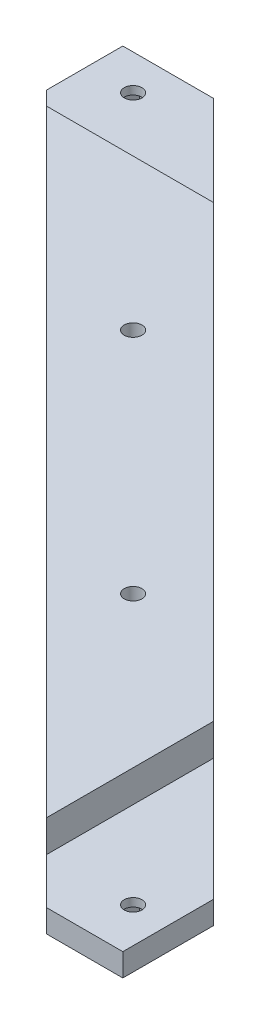
from build123d import *

# Parameters (mm, degrees)
BOSS_EXTRUDE1_DEPTH      = 12
SKETCH2_R                = 1.95
CUT_EXTRUDE1_DEPTH       = 244.540551038
SKETCH3_W                = 47
SKETCH3_H                = 27
SKETCH3_W_2              = 27
SKETCH3_H_2              = 47
CUT_EXTRUDE2_DEPTH       = 7
CUT_EXTRUDE8_DEPTH       = 244.540551038
CUT_EXTRUDE8_DEPTH_BACK  = 244.540551038
SKETCH5_R                = 1.95
CUT_EXTRUDE9_DEPTH       = 3.2
CUT_EXTRUDE10_DEPTH      = 244.540551038
CUT_EXTRUDE10_DEPTH_BACK = 244.540551038


with BuildPart() as part:
    # Sketch1 → Boss-Extrude1 (new body)
    with BuildSketch(Plane(origin=(0, 0, 0), x_dir=(1, 0, 0), z_dir=(0, 1, 0))):
        Polygon((0, 0), (20, 0), (172, -152), (172, -172), (155, -172), (0, -17), align=None)
    extrude(amount=BOSS_EXTRUDE1_DEPTH)

    # Sketch2 → Cut-Extrude1 (cut, through all)
    with BuildSketch(Plane(origin=(0, 12, 0), x_dir=(1, 0, 0), z_dir=(0, 1, 0))):
        with Locations(Location((10, -8, 0), (0, 0, 270))):
            Circle(SKETCH2_R)
        with Locations(Location((164, -162, 0), (0, 0, 270))):
            Circle(SKETCH2_R)
    extrude(amount=-CUT_EXTRUDE1_DEPTH, mode=Mode.SUBTRACT)

    # Sketch3 → Cut-Extrude2 (cut)
    with BuildSketch(Plane(origin=(0, 12, 0), x_dir=(1, 0, 0), z_dir=(0, 1, 0))):
        with Locations((23.5, -13.5)):
            Rectangle(SKETCH3_W, SKETCH3_H)
        with Locations((158.5, -148.5)):
            Rectangle(SKETCH3_W_2, SKETCH3_H_2)
    extrude(amount=-CUT_EXTRUDE2_DEPTH, mode=Mode.SUBTRACT)

    # Sketch5 → Cut-Extrude8 (cut, two sides: drawn at the far end of the back side and taken through both)
    with BuildSketch(Plane(origin=(0, 0, 0), x_dir=(1, 0, 0), z_dir=(0, 1, 0)).offset(-CUT_EXTRUDE8_DEPTH_BACK)):
        with Locations(Location((62, -60, 0), (0, 0, 270))):
            Circle(SKETCH5_R)
        with Locations(Location((112, -110, 0), (0, 0, 270))):
            Circle(SKETCH5_R)
    extrude(amount=CUT_EXTRUDE8_DEPTH + CUT_EXTRUDE8_DEPTH_BACK, mode=Mode.SUBTRACT)

    # Sketch7 → Cut-Extrude9 (cut)
    with BuildSketch(Plane.XZ):
        Polygon((13.983716857, 8), (11.991858429, 11.45), (8.008141571, 11.45), (6.016283143, 8), (8.008141571, 4.55), (11.991858429, 4.55), align=None)
        Polygon((167.983716857, 162), (165.991858429, 165.45), (162.008141571, 165.45), (160.016283143, 162), (162.008141571, 158.55), (165.991858429, 158.55), align=None)
    extrude(amount=-CUT_EXTRUDE9_DEPTH, mode=Mode.SUBTRACT)

    # Sketch8 → Cut-Extrude10 (cut, two sides: drawn at the far end of the back side and taken through both)
    with BuildSketch(Plane.XZ.offset(-CUT_EXTRUDE10_DEPTH_BACK)):
        Polygon((0, 0.25), (0, 0), (20, 0), (172, 152), (172, 172), (171.75, 172), (171.75, 152.103553391), (19.896446609, 0.25), align=None)
    extrude(amount=CUT_EXTRUDE10_DEPTH + CUT_EXTRUDE10_DEPTH_BACK, mode=Mode.SUBTRACT)


solid = part.part
